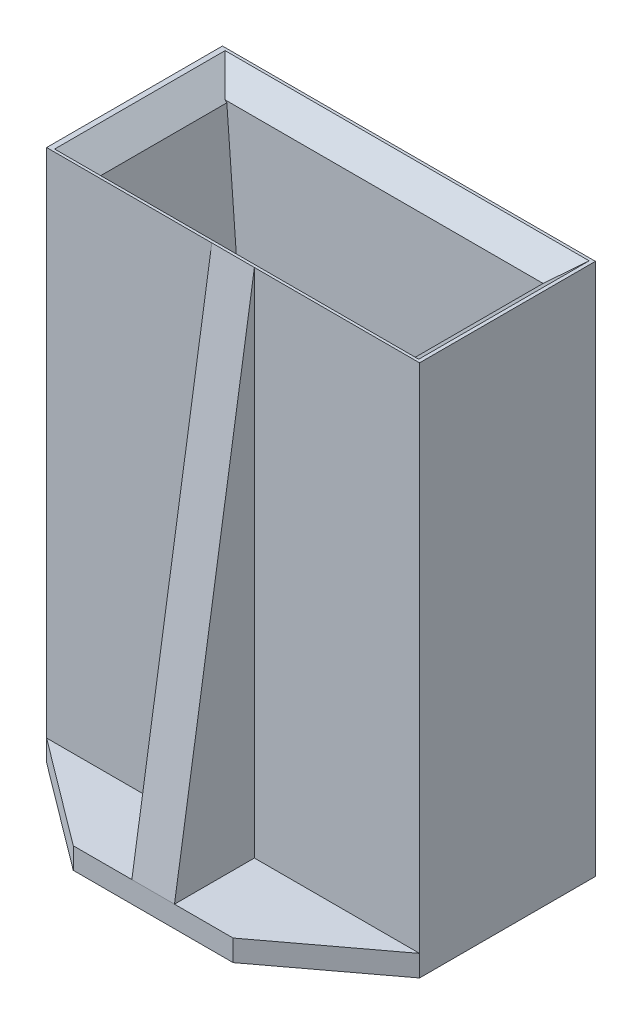
from build123d import *
from OCP.BRepFilletAPI import BRepFilletAPI_MakeChamfer

# Parameters (mm, degrees)
SKETCH1_W           = 70
SKETCH1_H           = 100
BOSS_EXTRUDE1_DEPTH = 16.5
CUT_EXTRUDE1_DEPTH  = 12
BOSS_EXTRUDE2_DEPTH = 4
BOSS_EXTRUDE3_DEPTH = 4
CHAMFER1_SIZE       = 4
CHAMFER1_SIZE2      = 4.335908163


with BuildPart() as part:
    # Sketch1 → Boss-Extrude1 (new, symmetric)
    with BuildSketch(Plane.XY):
        with Locations((35, 50)):
            Rectangle(SKETCH1_W, SKETCH1_H)
    extrude(amount=BOSS_EXTRUDE1_DEPTH, both=True)

    # Sketch2 → Cut-Extrude1 (cut, symmetric)
    with BuildSketch(Plane.XY):
        Polygon((5, 100), (65, 100), (57.511201523, 0), (12.488798477, 0), align=None)
    extrude(amount=CUT_EXTRUDE1_DEPTH, both=True, mode=Mode.SUBTRACT)

    # Sketch3 → Boss-Extrude2 (add)
    with BuildSketch(Plane.XZ):
        Polygon((0, 16.5), (20, 31.5), (50, 31.5), (70, 16.5), align=None)
        Polygon((50, -31.5), (70, -16.5), (0, -16.5), (20, -31.5), align=None)
    extrude(amount=-BOSS_EXTRUDE2_DEPTH)

    # Sketch5 → Boss-Extrude3 (add, symmetric)
    with BuildSketch(Plane.ZY.offset(-35)):
        Polygon((-16.5, 100), (-31.5, 4), (-16.5, 4), align=None)
        Polygon((31.5, 4), (16.5, 4), (16.5, 100), align=None)
    extrude(amount=BOSS_EXTRUDE3_DEPTH, both=True)

    # Chamfer1: one chamfer whose edges measure the first distance from different faces: ONE call of the kernel's chamfer builder (chamfer() names one face for all edges)
    chamfer1_edges_1 = [part.edges().sort_by_distance(p)[0] for p in [
        (35, 100, -12),
        (35, 100, 12),
    ]]
    chamfer1_edges_2 = [part.edges().sort_by_distance(p)[0] for p in [
        (5, 100, 0),
    ]]
    chamfer1_side_2 = [part.faces().sort_by_distance(p)[0] for p in [
        (69.226113703, 100, 0),
    ]]
    chamfer1_edges_3 = [part.edges().sort_by_distance(p)[0] for p in [
        (65, 100, 0),
    ]]
    chamfer1_side_3 = [part.faces().sort_by_distance(p)[0] for p in [
        (61.255600762, 50, 0),
    ]]
    chamfer1 = BRepFilletAPI_MakeChamfer(part.part.solid().wrapped)
    for e in chamfer1_edges_1:
        chamfer1.Add(CHAMFER1_SIZE, e.wrapped)
    for e in chamfer1_edges_2:
        chamfer1.Add(CHAMFER1_SIZE, CHAMFER1_SIZE2, e.wrapped, chamfer1_side_2[0].wrapped)  # the first distance lies on this face
    for e in chamfer1_edges_3:
        chamfer1.Add(CHAMFER1_SIZE, CHAMFER1_SIZE2, e.wrapped, chamfer1_side_3[0].wrapped)  # the first distance lies on this face
    add(Compound.cast(chamfer1.Shape()), mode=Mode.REPLACE)


solid = part.part
